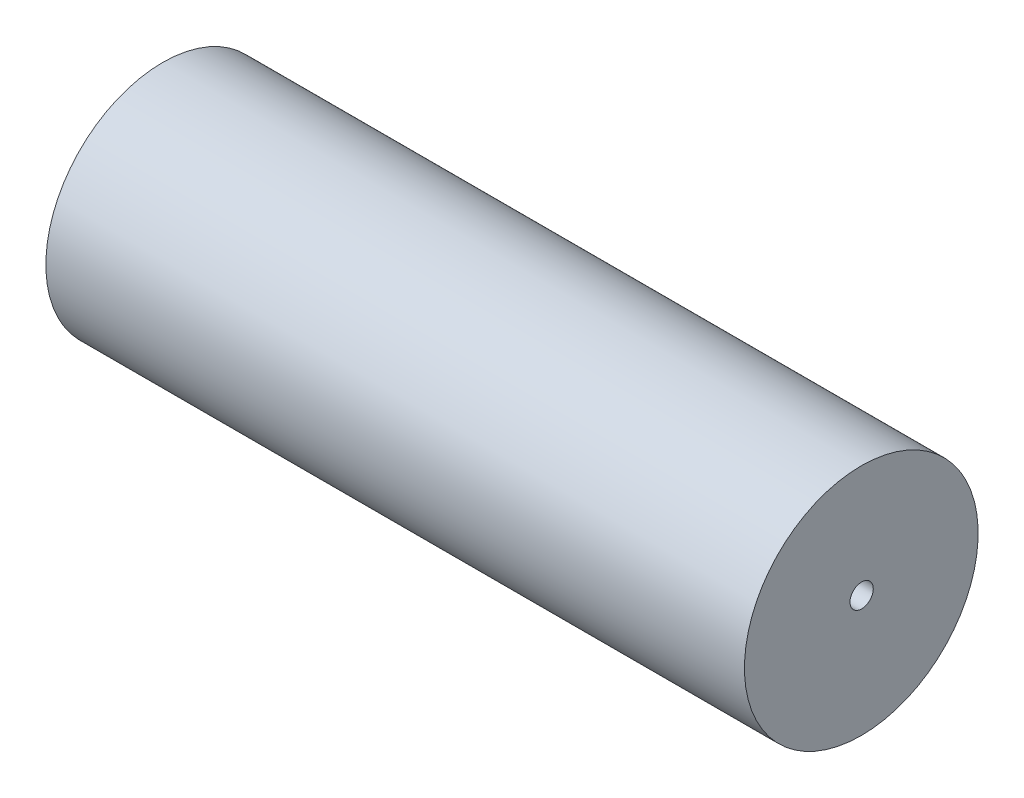
from build123d import *

# Parameters (mm, degrees)
SKETCH1_W               = 60
SKETCH1_H               = 10.035853858
CUT_EXTRUDE1_DEPTH      = 65.094417866
CUT_EXTRUDE1_DEPTH_BACK = 65.094417866
SKETCH2_R               = 1


with BuildPart() as part:
    # Sketch1 → Revolve1 (revolve)
    with BuildSketch(Plane.XY):
        with Locations((-5.085788225, 5.129777841)):
            Rectangle(SKETCH1_W, SKETCH1_H)
    revolve(axis=Axis((-35.085788225, 10.14770477, 0), (1, 0, 0)))

    # Sketch2 → Cut-Extrude1 (cut, two sides: drawn at the far end of the back side and taken through both)
    with BuildSketch(Plane(origin=(24.914211775, 0, 0), x_dir=(0, 0, -1), z_dir=(1, 0, 0)).offset(-CUT_EXTRUDE1_DEPTH_BACK)):
        with Locations(Location((0.028858499, 10.523100361, 0), (0, 0, 90))):
            Circle(SKETCH2_R)
    extrude(amount=CUT_EXTRUDE1_DEPTH + CUT_EXTRUDE1_DEPTH_BACK, mode=Mode.SUBTRACT)


solid = part.part
